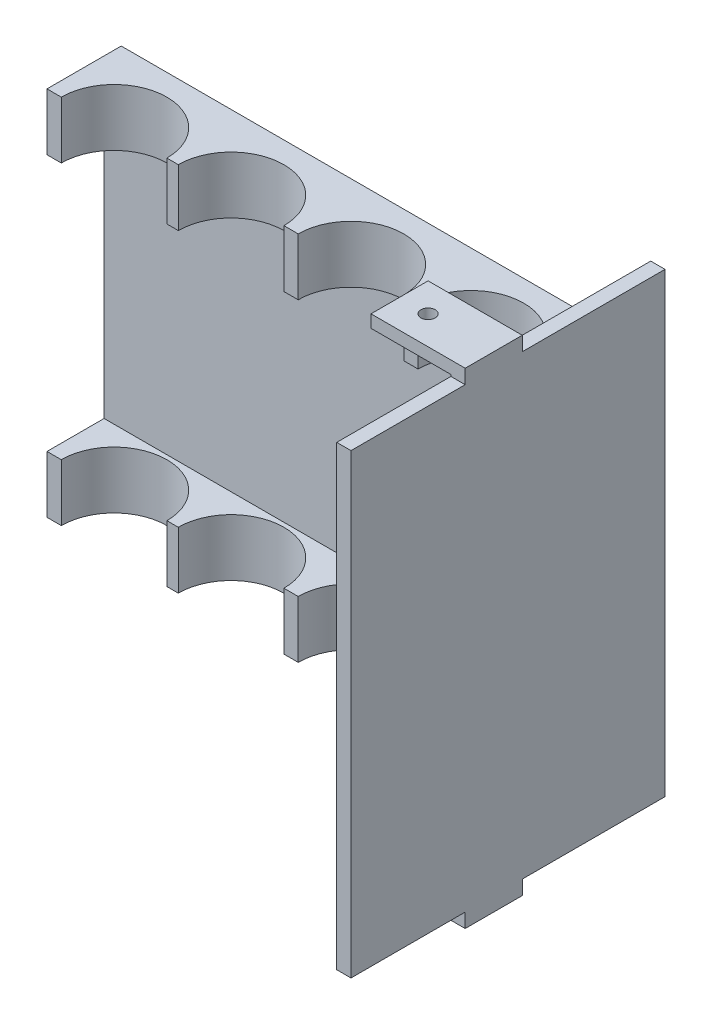
from build123d import *

# Parameters (mm, degrees)
ESBO_O1_W                = 80
ESBO_O1_H                = 65
RESSALTO_EXTRUS_O1_DEPTH = 13
ESBO_O3_W                = 13
ESBO_O3_H                = 65
RESSALTO_EXTRUS_O2_DEPTH = 6.5
CORTE_EXTRUS_O1_DEPTH    = 65
CORTE_EXTRUS_O2_REACH    = 110.978
ESBO_O5_W                = 10
ESBO_O5_H                = 45
RESSALTO_EXTRUS_O4_DEPTH = 2.5
ESBO_O7_W                = 16.5
ESBO_O7_H                = 10
RESSALTO_EXTRUS_O5_DEPTH = 2.5
ESBO_O9_R                = 1.25
CORTE_EXTRUS_O3_DEPTH    = 129.092983805
ESBO_O11_W               = 14
ESBO_O11_H               = 10
CORTE_EXTRUS_O4_DEPTH    = 0.3


with BuildPart() as part:
    # Esboço1 → Ressalto-extrusão1 (new body)
    with BuildSketch(Plane.XY):
        with Locations((40, 32.5)):
            Rectangle(ESBO_O1_W, ESBO_O1_H)
    extrude(amount=RESSALTO_EXTRUS_O1_DEPTH)

    # Esboço3 → Ressalto-extrusão2 (add)
    with BuildSketch(Plane.ZY):
        with Locations((6.5, 32.5)):
            Rectangle(ESBO_O3_W, ESBO_O3_H)
    extrude(amount=RESSALTO_EXTRUS_O2_DEPTH)

    # Esboço4 → Corte-extrusão1 (cut)
    with BuildSketch(Plane(origin=(0, 0, 0), x_dir=(-1, 0, 0), z_dir=(0, -1, 0))):
        with BuildLine():
            ThreePointArc((-14.5, -13), (-5.25, -22.25), (4, -13))
            Line((4, -13), (-5.25, -13))
            Line((-5.25, -13), (-14.5, -13))
        make_face()
        with BuildLine():
            Line((-5.25, -13), (4, -13))
            ThreePointArc((4, -13), (-5.25, -3.75), (-14.5, -13))
            Line((-14.5, -13), (-5.25, -13))
        make_face()
        with BuildLine():
            ThreePointArc((-35, -13), (-25.75, -22.25), (-16.5, -13))
            Line((-16.5, -13), (-25.75, -13))
            Line((-25.75, -13), (-35, -13))
        make_face()
        with BuildLine():
            Line((-25.75, -13), (-16.5, -13))
            ThreePointArc((-16.5, -13), (-25.75, -3.75), (-35, -13))
            Line((-35, -13), (-25.75, -13))
        make_face()
        with BuildLine():
            ThreePointArc((-56, -13), (-46.75, -22.25), (-37.5, -13))
            Line((-37.5, -13), (-46.75, -13))
            Line((-46.75, -13), (-56, -13))
        make_face()
        with BuildLine():
            Line((-46.75, -13), (-37.5, -13))
            ThreePointArc((-37.5, -13), (-46.75, -3.75), (-56, -13))
            Line((-56, -13), (-46.75, -13))
        make_face()
        with BuildLine():
            ThreePointArc((-77, -13), (-67.75, -22.25), (-58.5, -13))
            Line((-58.5, -13), (-67.75, -13))
            Line((-67.75, -13), (-77, -13))
        make_face()
        with BuildLine():
            Line((-67.75, -13), (-58.5, -13))
            ThreePointArc((-58.5, -13), (-67.75, -3.75), (-77, -13))
            Line((-77, -13), (-67.75, -13))
        make_face()
    extrude(amount=-CORTE_EXTRUS_O1_DEPTH, mode=Mode.SUBTRACT)

    # Esboço5 → Corte-extrusão2 (cut, up to next)
    with BuildSketch(Plane(origin=(80, 0, 0), x_dir=(0, 0, -1), z_dir=(1, 0, 0)), mode=Mode.PRIVATE) as corte_extrus_o2_sk1:
        with Locations((-8, 32.5)):
            Rectangle(ESBO_O5_W, ESBO_O5_H)
    corte_extrus_o2_tool1 = extrude(corte_extrus_o2_sk1.sketch, amount=-CORTE_EXTRUS_O2_REACH, mode=Mode.PRIVATE) & part.part
    add(corte_extrus_o2_tool1.solids().sort_by_distance((80, 32.5, 8))[0], mode=Mode.SUBTRACT)

    # Esboço6 → Ressalto-extrusão4 (add)
    with BuildSketch(Plane(origin=(80, 0, 0), x_dir=(0, 0, -1), z_dir=(1, 0, 0))):
        Polygon((6.25, -7.5), (6.25, 32.5), (6.25, 72.5), (-48.75, 72.5), (-48.75, -7.5), align=None)
    extrude(amount=RESSALTO_EXTRUS_O4_DEPTH)

    # Esboço7 → Ressalto-extrusão5 (add)
    with BuildSketch(Plane(origin=(0, 72.5, 0), x_dir=(1, 0, 0), z_dir=(0, 1, 0))):
        with Locations((74.25, -23.75)):
            Rectangle(ESBO_O7_W, ESBO_O7_H)
    ressalto_extrus_o5 = extrude(amount=RESSALTO_EXTRUS_O5_DEPTH)

    # Espelhar1: Ressalto-extrusão5 across plane
    add(ressalto_extrus_o5.mirror(Plane(origin=(0, 32.5, 0), x_dir=(0, 0, 1), z_dir=(0, -1, 0))))

    # Esboço9 → Corte-extrusão3 (cut, through all)
    with BuildSketch(Plane(origin=(0, 75, 0), x_dir=(1, 0, 0), z_dir=(0, 1, 0))):
        with Locations(Location((71, -23.75, 0), (0, 0, 270))):
            Circle(ESBO_O9_R)
    extrude(amount=-CORTE_EXTRUS_O3_DEPTH, mode=Mode.SUBTRACT)

    # Esboço11 → Corte-extrusão4 (cut)
    with BuildSketch(Plane.XZ.offset(-72.5)):
        with Locations((73, 23.75)):
            Rectangle(ESBO_O11_W, ESBO_O11_H)
    corte_extrus_o4 = extrude(amount=-CORTE_EXTRUS_O4_DEPTH, mode=Mode.SUBTRACT)

    # Espelhar2: Corte-extrusão4 across plane
    add(corte_extrus_o4.mirror(Plane(origin=(0, 32.5, 0), x_dir=(0, 0, 1), z_dir=(0, -1, 0))), mode=Mode.SUBTRACT)


solid = part.part
